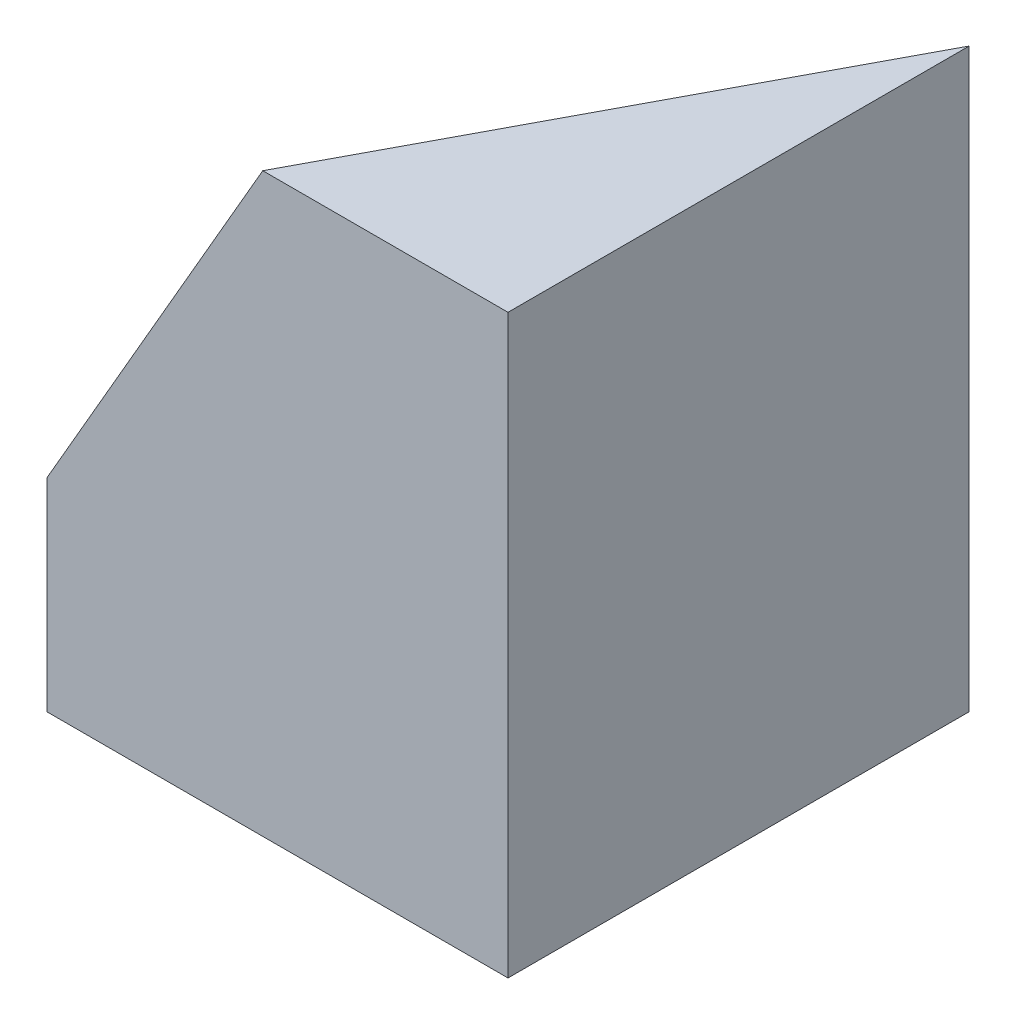
from build123d import *

# Parameters (mm, degrees)
SKETCH_1_W      = 48
SKETCH_1_H      = 48
EXTRUDE_1_DEPTH = 60


with BuildPart() as part:
    # 草图1 → 凸台-拉伸1 (new body)
    with BuildSketch(Plane(origin=(0, 0, 0), x_dir=(1, 0, 0), z_dir=(0, 1, 0))):
        Rectangle(SKETCH_1_W, SKETCH_1_H)
    extrude(amount=EXTRUDE_1_DEPTH)

    # Surface Cut 1
    split(bisect_by=Plane(origin=(-14.481029553, 8.36062631, -7.699699993), x_dir=(0.3622245100921348, -0.20913041840877658, -0.9083269633698446), z_dir=(0.7866342252206607, -0.45416348168492593, 0.41826083681754983)), keep=Keep.TOP)


solid = part.part
